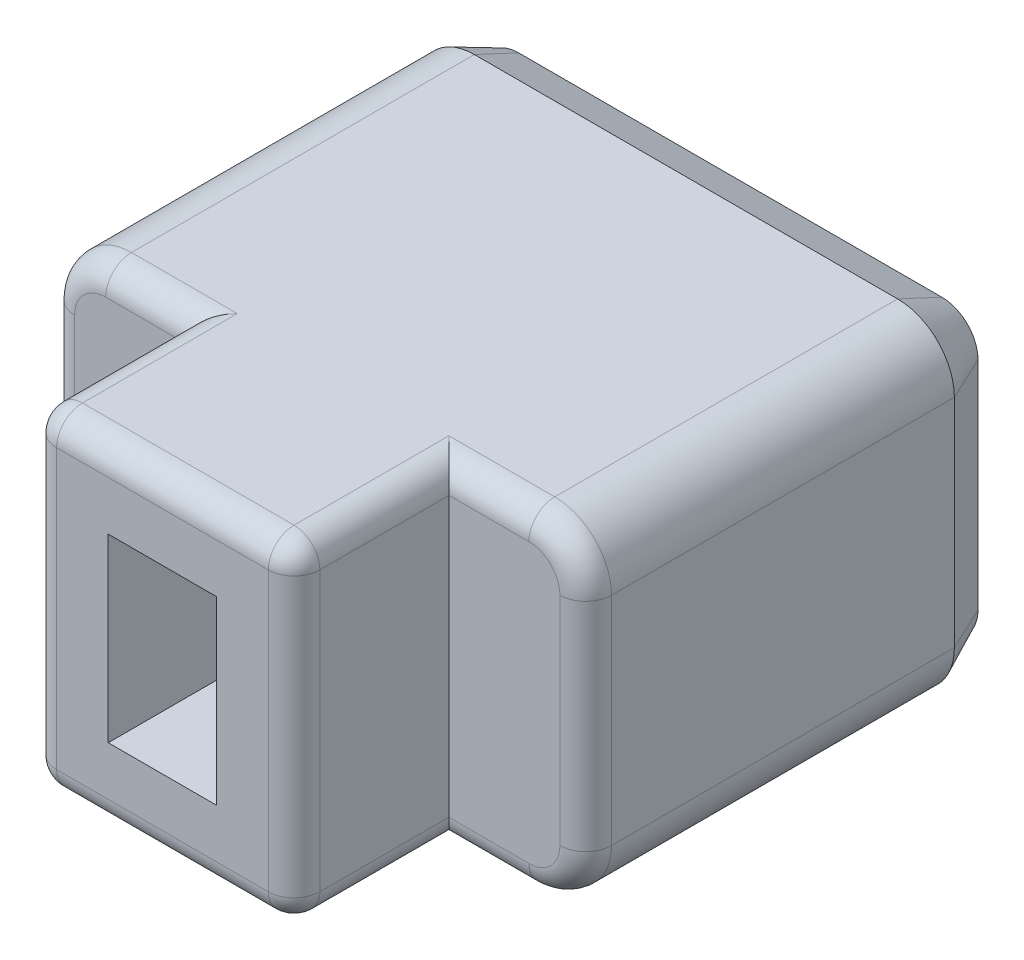
from build123d import *

# Parameters (mm, degrees)
BOSS_EXTRU_1_DEPTH      = 11
ESQUISSE3_W             = 2.1
ESQUISSE3_H             = 3.5
ENL_V_MAT_EXTRU_1_DEPTH = 3
ESQUISSE4_OUTSIDE_W     = 15.688
ESQUISSE4_OUTSIDE_H     = 11.688
ESQUISSE4_OUTSIDE_W_2   = 5.1
ESQUISSE4_OUTSIDE_H_2   = 6.4
ENL_V_MAT_EXTRU_2_DEPTH = 3
CONG_1_R                = 0.5
CHANFREIN1_SIZE         = 0.4
CHANFREIN1_SIZE2        = 0.857802768
ENL_V_MAT_EXTRU_3_DEPTH = 0.3
BOSS_EXTRU_2_DEPTH      = 0.3


with BuildPart() as part:
    # Esquisse2 → Boss.-Extru.1 (new body)
    with BuildSketch(Plane.XY):
        with BuildLine():
            Line((1.1, 0), (9.3, 0))
            ThreePointArc((9.3, 0), (10.077817459, 0.322182541), (10.4, 1.1))
            Line((10.4, 1.1), (10.4, 5.3))
            ThreePointArc((10.4, 5.3), (10.077817459, 6.077817459), (9.3, 6.4))
            Line((9.3, 6.4), (1.1, 6.4))
            ThreePointArc((1.1, 6.4), (0.322182541, 6.077817459), (0, 5.3))
            Line((0, 5.3), (0, 1.1))
            ThreePointArc((0, 1.1), (0.322182541, 0.322182541), (1.1, 0))
        make_face()
    extrude(amount=BOSS_EXTRU_1_DEPTH)

    # Esquisse3 → Enlèv. mat.-Extru.1 (cut)
    with BuildSketch(Plane.XY.offset(11)):
        with Locations((5.2, 3.2)):
            Rectangle(ESQUISSE3_W, ESQUISSE3_H)
    extrude(amount=-ENL_V_MAT_EXTRU_1_DEPTH, mode=Mode.SUBTRACT)

    # Esquisse4 outside → Enlèv. mat.-Extru.2 (cut)
    with BuildSketch(Plane.XY.offset(11)):
        with Locations((5.2, 3.2)):
            Rectangle(ESQUISSE4_OUTSIDE_W, ESQUISSE4_OUTSIDE_H)
        with Locations((5.2, 3.2)):
            Rectangle(ESQUISSE4_OUTSIDE_W_2, ESQUISSE4_OUTSIDE_H_2, mode=Mode.SUBTRACT)
    extrude(amount=-ENL_V_MAT_EXTRU_2_DEPTH, mode=Mode.SUBTRACT)

    # Congé1
    cong_1_edges = [part.edges().sort_by_distance(p)[0] for p in [
        (8.525, 0, 8),
        (10.077817459, 0.322182541, 8),
        (10.4, 3.2, 8),
        (10.077817459, 6.077817459, 8),
        (1.875, 6.4, 8),
        (0.322182541, 6.077817459, 8),
        (1.875, 0, 8),
        (0.322182541, 0.322182541, 8),
        (7.75, 6.4, 9.5),
        (2.65, 6.4, 9.5),
        (7.75, 0, 9.5),
        (2.65, 0, 9.5),
        (2.65, 3.2, 11),
        (5.2, 6.4, 11),
        (7.75, 3.2, 11),
        (5.2, 0, 11),
        (8.525, 6.4, 8),
        (0, 3.2, 8),
    ]]
    fillet(cong_1_edges, radius=CONG_1_R)

    # Chanfrein1
    chanfrein1_edges = [part.edges().sort_by_distance(p)[0] for p in [
        (5.2, 0, 0),
        (10.077817459, 0.322182541, 0),
        (0.322182541, 0.322182541, 0),
        (10.4, 3.2, 0),
        (0, 3.2, 0),
        (10.077817459, 6.077817459, 0),
        (0.322182541, 6.077817459, 0),
        (5.2, 6.4, 0),
    ]]
    chanfrein1_side = [part.faces().sort_by_distance(p)[0] for p in [
        (5.2, 3.2, 0),
    ]]
    chamfer(chanfrein1_edges, length=CHANFREIN1_SIZE, length2=CHANFREIN1_SIZE2, reference=chanfrein1_side[0])

    # Esquisse5 → Enlèv. mat.-Extru.3 (cut)
    with BuildSketch(Plane(origin=(0, 0, 0), x_dir=(-1, 0, 0), z_dir=(0, 0, -1))):
        with BuildLine():
            add(Edge.make_bspline(
                [(-4.020512821, 3.301602564), (-4.020911895, 3.237490288), (-4.021687033, 3.112962487), (-4.029453623, 2.931576965), (-4.039657895, 2.761233687), (-4.057122867, 2.602328729), (-4.077002379, 2.454537409), (-4.103898836, 2.318336336), (-4.133686676, 2.192920764), (-4.169367746, 2.078306948), (-4.208966747, 1.972487166), (-4.251922765, 1.873844337), (-4.299609469, 1.781939083), (-4.350581864, 1.696493671), (-4.40515217, 1.617040024), (-4.464689277, 1.545195476), (-4.527264604, 1.478966922), (-4.593628357, 1.419548449), (-4.663626219, 1.367872957), (-4.73456264, 1.321609448), (-4.808375288, 1.283870803), (-4.883914016, 1.252464116), (-4.961582673, 1.227486437), (-5.041500205, 1.209823218), (-5.123314642, 1.199090447), (-5.178600222, 1.197989634), (-5.206410256, 1.197435897)],
                knots=[0, 0, 0, 0, 1.712877019, 3.326988582, 4.850328076, 6.271266393, 7.597414044, 8.833253358, 9.979089379, 11.039995979, 12.038127203, 12.996775837, 13.912827748, 14.802594919, 15.653836721, 16.485345673, 17.29299284, 18.086549745, 18.861567364, 19.615803961, 20.346722131, 21.07299196, 21.799717448, 22.523458425, 23.25726252, 24, 24, 24, 24], degree=3))
            add(Edge.make_bspline(
                [(-5.206410256, 1.197435897), (-5.234773835, 1.197856676), (-5.290931895, 1.19868979), (-5.373768848, 1.211289031), (-5.455148845, 1.226953307), (-5.533810837, 1.252867378), (-5.61135316, 1.283376293), (-5.685468102, 1.32376974), (-5.75931599, 1.368008245), (-5.829261029, 1.421642984), (-5.898136448, 1.480451636), (-5.961439201, 1.54819639), (-6.022536833, 1.621629), (-6.078767075, 1.702788043), (-6.133147302, 1.790327967), (-6.182067331, 1.885541033), (-6.228148466, 1.987395506), (-6.270739365, 2.096320958), (-6.308639603, 2.214278611), (-6.34094501, 2.341477387), (-6.369350367, 2.478020647), (-6.390869392, 2.624206004), (-6.410234178, 2.779852196), (-6.420894706, 2.945461394), (-6.429824742, 3.120416408), (-6.430448929, 3.240157327), (-6.430769231, 3.301602564)],
                knots=[0, 0, 0, 0, 0.75220614, 1.489319695, 2.220852219, 2.949733443, 3.684523869, 4.429947492, 5.187648757, 5.967684849, 6.766858157, 7.589441672, 8.425666629, 9.301140101, 10.208430577, 11.15995201, 12.140621658, 13.175675118, 14.263319269, 15.427708189, 16.65850267, 17.964291952, 19.349626439, 20.821361425, 22.36887671, 24, 24, 24, 24], degree=3))
            add(Edge.make_bspline(
                [(-6.430769231, 3.301602564), (-6.430305798, 3.362772851), (-6.429400854, 3.482219717), (-6.422438193, 3.656491702), (-6.409516659, 3.821099271), (-6.392113842, 3.975880645), (-6.369738278, 4.121323191), (-6.342767352, 4.257209095), (-6.311127821, 4.383693823), (-6.272926435, 4.500301893), (-6.231316538, 4.608939827), (-6.185570494, 4.710359268), (-6.135679901, 4.804839083), (-6.083447544, 4.893272292), (-6.025939867, 4.9738605), (-5.965001727, 5.047871088), (-5.900246961, 5.11521968), (-5.831706612, 5.175510083), (-5.760942229, 5.229184526), (-5.687219152, 5.275093881), (-5.612067139, 5.314500495), (-5.534640973, 5.346843735), (-5.455223062, 5.371759948), (-5.373900341, 5.389028282), (-5.290912286, 5.401226646), (-5.234767255, 5.402115282), (-5.206410256, 5.402564103)],
                knots=[0, 0, 0, 0, 1.625926502, 3.174937312, 4.634762286, 6.013840289, 7.314135796, 8.544953558, 9.695183173, 10.777339882, 11.80441546, 12.786228703, 13.732569224, 14.643300609, 15.513996549, 16.361191109, 17.189646031, 17.994430762, 18.785317065, 19.547646725, 20.300227906, 21.038576587, 21.77507982, 22.508943555, 23.246916685, 24, 24, 24, 24], degree=3))
            add(Edge.make_bspline(
                [(-5.206410256, 5.402564103), (-5.178600626, 5.402008333), (-5.12331585, 5.400903477), (-5.041495467, 5.390200606), (-4.961927768, 5.372498277), (-4.884580833, 5.348113076), (-4.808735986, 5.318115591), (-4.735861577, 5.278841166), (-4.664487612, 5.234097305), (-4.595222355, 5.182839794), (-4.529714735, 5.123954272), (-4.466751428, 5.05907494), (-4.408306603, 4.986310676), (-4.353077748, 4.907111679), (-4.301846212, 4.82107942), (-4.254304118, 4.728554016), (-4.211513446, 4.62894977), (-4.170950898, 4.522524223), (-4.134313743, 4.407207152), (-4.104784709, 4.281097892), (-4.078108159, 4.144586926), (-4.056489297, 3.997009974), (-4.04121196, 3.838384286), (-4.028981243, 3.669013656), (-4.021823954, 3.488897211), (-4.020957867, 3.365177206), (-4.020512821, 3.301602564)],
                knots=[0, 0, 0, 0, 0.743633083, 1.478322008, 2.202935681, 2.92157138, 3.646008898, 4.381114629, 5.13243131, 5.898384423, 6.682810379, 7.486269515, 8.314261655, 9.176475297, 10.067315361, 10.990823262, 11.957174424, 12.9657133, 14.036849175, 15.191010145, 16.42833965, 17.757104916, 19.17902079, 20.690427988, 22.299346516, 24, 24, 24, 24], degree=3))
        make_face()
        with BuildLine():
            add(Edge.make_bspline(
                [(-4.379487179, 3.3), (-4.379779587, 3.35342219), (-4.380346983, 3.457084295), (-4.385135243, 3.607509198), (-4.393150158, 3.748039045), (-4.403751897, 3.87854911), (-4.419474197, 3.998686179), (-4.436327385, 4.109049288), (-4.458195662, 4.208923878), (-4.48220677, 4.299943929), (-4.509664627, 4.383098612), (-4.540180964, 4.460417645), (-4.573871506, 4.532671188), (-4.610400803, 4.600127923), (-4.650953047, 4.661797332), (-4.692973295, 4.719458073), (-4.739951793, 4.770446886), (-4.803765354, 4.831502164), (-4.8877326, 4.89483389), (-4.994460009, 4.950833116), (-5.104920314, 4.985539091), (-5.180267725, 4.990064032), (-5.217628205, 4.992307692)],
                knots=[0, 0, 0, 0, 1.533890677, 2.976409912, 4.32068653, 5.57534731, 6.734899526, 7.799022707, 8.779764529, 9.668979878, 10.500817703, 11.292628284, 12.054302458, 12.788773575, 13.492867708, 14.172349036, 14.834736512, 15.480260857, 16.707312048, 17.839247027, 18.928605951, 20, 20, 20, 20], degree=3))
            add(Edge.make_bspline(
                [(-5.217628205, 4.992307692), (-5.255258229, 4.990389299), (-5.330571538, 4.986549798), (-5.440929763, 4.952267022), (-5.547048839, 4.897685219), (-5.630071512, 4.835174339), (-5.692917561, 4.775508814), (-5.738412243, 4.724653285), (-5.77964842, 4.667650104), (-5.818091825, 4.60559545), (-5.854487742, 4.538574624), (-5.887978618, 4.466161896), (-5.917570334, 4.387773449), (-5.934766088, 4.333472445), (-5.943589744, 4.305608974)],
                knots=[0, 0, 0, 0, 1.259681964, 2.521146828, 3.839396011, 5.247784635, 5.989235103, 6.744415315, 7.532874599, 8.345794243, 9.191666684, 10.089598853, 11.019715999, 12, 12, 12, 12], degree=3))
            add(Edge.make_bspline(
                [(-5.943589744, 4.305608974), (-5.953720959, 4.269886717), (-5.974334837, 4.19720302), (-6.001119453, 4.084815833), (-6.021943913, 3.966950118), (-6.041121335, 3.844185221), (-6.053890378, 3.715740449), (-6.064938775, 3.581950987), (-6.069986658, 3.442665729), (-6.071185495, 3.348079077), (-6.071794872, 3.3)],
                knots=[0, 0, 0, 0, 0.875956533, 1.782299469, 2.724069677, 3.698984639, 4.712850366, 5.768333165, 6.865627682, 8, 8, 8, 8], degree=3))
            add(Edge.make_bspline(
                [(-6.071794872, 3.3), (-6.071584733, 3.251915565), (-6.07117364, 3.157848583), (-6.065125373, 3.020268389), (-6.056917984, 2.889261457), (-6.043393351, 2.765138771), (-6.029287693, 2.6472717), (-6.008647133, 2.536498336), (-5.985686678, 2.432182443), (-5.95923148, 2.334316961), (-5.929979671, 2.242949321), (-5.896586545, 2.158459438), (-5.861857442, 2.079681886), (-5.823226662, 2.007580001), (-5.782462568, 1.941593056), (-5.738905975, 1.881777873), (-5.692898579, 1.828043293), (-5.628385253, 1.767291709), (-5.544808554, 1.704214198), (-5.438953102, 1.64849731), (-5.329182829, 1.614567615), (-5.254711982, 1.609977846), (-5.217628205, 1.607692308)],
                knots=[0, 0, 0, 0, 1.380925582, 2.701487514, 3.954759264, 5.150134482, 6.287201315, 7.363077027, 8.384863176, 9.354399778, 10.273840592, 11.138560363, 11.96264889, 12.745125087, 13.485915552, 14.188670158, 14.868482057, 15.51419708, 16.73087182, 17.863141155, 18.935921919, 20, 20, 20, 20], degree=3))
            add(Edge.make_bspline(
                [(-5.217628205, 1.607692308), (-5.180016158, 1.609983366), (-5.104508137, 1.614582777), (-4.993344019, 1.648315702), (-4.886608666, 1.704014744), (-4.802784125, 1.767221715), (-4.739080074, 1.827657633), (-4.693352401, 1.879199527), (-4.650532879, 1.935582312), (-4.61137998, 1.997766084), (-4.574810877, 2.06470837), (-4.5408126, 2.136564551), (-4.510413915, 2.213687917), (-4.483306315, 2.296997893), (-4.457601906, 2.387603306), (-4.437762769, 2.488237199), (-4.41873708, 2.598723374), (-4.405310355, 2.719729036), (-4.392696573, 2.85028734), (-4.38524976, 2.991168731), (-4.380313644, 3.142110882), (-4.37976822, 3.24630947), (-4.379487179, 3.3)],
                knots=[0, 0, 0, 0, 1.078426572, 2.164993967, 3.303109781, 4.518750912, 5.163917377, 5.820815102, 6.493793122, 7.193352139, 7.927416062, 8.681729197, 9.473100796, 10.304477447, 11.195213749, 12.173822244, 13.246157428, 14.41173915, 15.666383497, 17.009914843, 18.459295279, 20, 20, 20, 20], degree=3))
        make_face(mode=Mode.SUBTRACT)
    extrude(amount=-ENL_V_MAT_EXTRU_3_DEPTH, mode=Mode.SUBTRACT)


with BuildPart() as body_2:
    # Esquisse5<2> → Boss.-Extru.2 (new body)
    with BuildSketch(Plane(origin=(0, 0, 0), x_dir=(-1, 0, 0), z_dir=(0, 0, -1))):
        with BuildLine():
            add(Edge.make_bspline(
                [(-4.020512821, 3.301602564), (-4.020911895, 3.237490288), (-4.021687033, 3.112962487), (-4.029453623, 2.931576965), (-4.039657895, 2.761233687), (-4.057122867, 2.602328729), (-4.077002379, 2.454537409), (-4.103898836, 2.318336336), (-4.133686676, 2.192920764), (-4.169367746, 2.078306948), (-4.208966747, 1.972487166), (-4.251922765, 1.873844337), (-4.299609469, 1.781939083), (-4.350581864, 1.696493671), (-4.40515217, 1.617040024), (-4.464689277, 1.545195476), (-4.527264604, 1.478966922), (-4.593628357, 1.419548449), (-4.663626219, 1.367872957), (-4.73456264, 1.321609448), (-4.808375288, 1.283870803), (-4.883914016, 1.252464116), (-4.961582673, 1.227486437), (-5.041500205, 1.209823218), (-5.123314642, 1.199090447), (-5.178600222, 1.197989634), (-5.206410256, 1.197435897)],
                knots=[0, 0, 0, 0, 1.712877019, 3.326988582, 4.850328076, 6.271266393, 7.597414044, 8.833253358, 9.979089379, 11.039995979, 12.038127203, 12.996775837, 13.912827748, 14.802594919, 15.653836721, 16.485345673, 17.29299284, 18.086549745, 18.861567364, 19.615803961, 20.346722131, 21.07299196, 21.799717448, 22.523458425, 23.25726252, 24, 24, 24, 24], degree=3))
            add(Edge.make_bspline(
                [(-5.206410256, 1.197435897), (-5.234773835, 1.197856676), (-5.290931895, 1.19868979), (-5.373768848, 1.211289031), (-5.455148845, 1.226953307), (-5.533810837, 1.252867378), (-5.61135316, 1.283376293), (-5.685468102, 1.32376974), (-5.75931599, 1.368008245), (-5.829261029, 1.421642984), (-5.898136448, 1.480451636), (-5.961439201, 1.54819639), (-6.022536833, 1.621629), (-6.078767075, 1.702788043), (-6.133147302, 1.790327967), (-6.182067331, 1.885541033), (-6.228148466, 1.987395506), (-6.270739365, 2.096320958), (-6.308639603, 2.214278611), (-6.34094501, 2.341477387), (-6.369350367, 2.478020647), (-6.390869392, 2.624206004), (-6.410234178, 2.779852196), (-6.420894706, 2.945461394), (-6.429824742, 3.120416408), (-6.430448929, 3.240157327), (-6.430769231, 3.301602564)],
                knots=[0, 0, 0, 0, 0.75220614, 1.489319695, 2.220852219, 2.949733443, 3.684523869, 4.429947492, 5.187648757, 5.967684849, 6.766858157, 7.589441672, 8.425666629, 9.301140101, 10.208430577, 11.15995201, 12.140621658, 13.175675118, 14.263319269, 15.427708189, 16.65850267, 17.964291952, 19.349626439, 20.821361425, 22.36887671, 24, 24, 24, 24], degree=3))
            add(Edge.make_bspline(
                [(-6.430769231, 3.301602564), (-6.430305798, 3.362772851), (-6.429400854, 3.482219717), (-6.422438193, 3.656491702), (-6.409516659, 3.821099271), (-6.392113842, 3.975880645), (-6.369738278, 4.121323191), (-6.342767352, 4.257209095), (-6.311127821, 4.383693823), (-6.272926435, 4.500301893), (-6.231316538, 4.608939827), (-6.185570494, 4.710359268), (-6.135679901, 4.804839083), (-6.083447544, 4.893272292), (-6.025939867, 4.9738605), (-5.965001727, 5.047871088), (-5.900246961, 5.11521968), (-5.831706612, 5.175510083), (-5.760942229, 5.229184526), (-5.687219152, 5.275093881), (-5.612067139, 5.314500495), (-5.534640973, 5.346843735), (-5.455223062, 5.371759948), (-5.373900341, 5.389028282), (-5.290912286, 5.401226646), (-5.234767255, 5.402115282), (-5.206410256, 5.402564103)],
                knots=[0, 0, 0, 0, 1.625926502, 3.174937312, 4.634762286, 6.013840289, 7.314135796, 8.544953558, 9.695183173, 10.777339882, 11.80441546, 12.786228703, 13.732569224, 14.643300609, 15.513996549, 16.361191109, 17.189646031, 17.994430762, 18.785317065, 19.547646725, 20.300227906, 21.038576587, 21.77507982, 22.508943555, 23.246916685, 24, 24, 24, 24], degree=3))
            add(Edge.make_bspline(
                [(-5.206410256, 5.402564103), (-5.178600626, 5.402008333), (-5.12331585, 5.400903477), (-5.041495467, 5.390200606), (-4.961927768, 5.372498277), (-4.884580833, 5.348113076), (-4.808735986, 5.318115591), (-4.735861577, 5.278841166), (-4.664487612, 5.234097305), (-4.595222355, 5.182839794), (-4.529714735, 5.123954272), (-4.466751428, 5.05907494), (-4.408306603, 4.986310676), (-4.353077748, 4.907111679), (-4.301846212, 4.82107942), (-4.254304118, 4.728554016), (-4.211513446, 4.62894977), (-4.170950898, 4.522524223), (-4.134313743, 4.407207152), (-4.104784709, 4.281097892), (-4.078108159, 4.144586926), (-4.056489297, 3.997009974), (-4.04121196, 3.838384286), (-4.028981243, 3.669013656), (-4.021823954, 3.488897211), (-4.020957867, 3.365177206), (-4.020512821, 3.301602564)],
                knots=[0, 0, 0, 0, 0.743633083, 1.478322008, 2.202935681, 2.92157138, 3.646008898, 4.381114629, 5.13243131, 5.898384423, 6.682810379, 7.486269515, 8.314261655, 9.176475297, 10.067315361, 10.990823262, 11.957174424, 12.9657133, 14.036849175, 15.191010145, 16.42833965, 17.757104916, 19.17902079, 20.690427988, 22.299346516, 24, 24, 24, 24], degree=3))
        make_face()
        with BuildLine():
            add(Edge.make_bspline(
                [(-4.379487179, 3.3), (-4.379779587, 3.35342219), (-4.380346983, 3.457084295), (-4.385135243, 3.607509198), (-4.393150158, 3.748039045), (-4.403751897, 3.87854911), (-4.419474197, 3.998686179), (-4.436327385, 4.109049288), (-4.458195662, 4.208923878), (-4.48220677, 4.299943929), (-4.509664627, 4.383098612), (-4.540180964, 4.460417645), (-4.573871506, 4.532671188), (-4.610400803, 4.600127923), (-4.650953047, 4.661797332), (-4.692973295, 4.719458073), (-4.739951793, 4.770446886), (-4.803765354, 4.831502164), (-4.8877326, 4.89483389), (-4.994460009, 4.950833116), (-5.104920314, 4.985539091), (-5.180267725, 4.990064032), (-5.217628205, 4.992307692)],
                knots=[0, 0, 0, 0, 1.533890677, 2.976409912, 4.32068653, 5.57534731, 6.734899526, 7.799022707, 8.779764529, 9.668979878, 10.500817703, 11.292628284, 12.054302458, 12.788773575, 13.492867708, 14.172349036, 14.834736512, 15.480260857, 16.707312048, 17.839247027, 18.928605951, 20, 20, 20, 20], degree=3))
            add(Edge.make_bspline(
                [(-5.217628205, 4.992307692), (-5.255258229, 4.990389299), (-5.330571538, 4.986549798), (-5.440929763, 4.952267022), (-5.547048839, 4.897685219), (-5.630071512, 4.835174339), (-5.692917561, 4.775508814), (-5.738412243, 4.724653285), (-5.77964842, 4.667650104), (-5.818091825, 4.60559545), (-5.854487742, 4.538574624), (-5.887978618, 4.466161896), (-5.917570334, 4.387773449), (-5.934766088, 4.333472445), (-5.943589744, 4.305608974)],
                knots=[0, 0, 0, 0, 1.259681964, 2.521146828, 3.839396011, 5.247784635, 5.989235103, 6.744415315, 7.532874599, 8.345794243, 9.191666684, 10.089598853, 11.019715999, 12, 12, 12, 12], degree=3))
            add(Edge.make_bspline(
                [(-5.943589744, 4.305608974), (-5.953720959, 4.269886717), (-5.974334837, 4.19720302), (-6.001119453, 4.084815833), (-6.021943913, 3.966950118), (-6.041121335, 3.844185221), (-6.053890378, 3.715740449), (-6.064938775, 3.581950987), (-6.069986658, 3.442665729), (-6.071185495, 3.348079077), (-6.071794872, 3.3)],
                knots=[0, 0, 0, 0, 0.875956533, 1.782299469, 2.724069677, 3.698984639, 4.712850366, 5.768333165, 6.865627682, 8, 8, 8, 8], degree=3))
            add(Edge.make_bspline(
                [(-6.071794872, 3.3), (-6.071584733, 3.251915565), (-6.07117364, 3.157848583), (-6.065125373, 3.020268389), (-6.056917984, 2.889261457), (-6.043393351, 2.765138771), (-6.029287693, 2.6472717), (-6.008647133, 2.536498336), (-5.985686678, 2.432182443), (-5.95923148, 2.334316961), (-5.929979671, 2.242949321), (-5.896586545, 2.158459438), (-5.861857442, 2.079681886), (-5.823226662, 2.007580001), (-5.782462568, 1.941593056), (-5.738905975, 1.881777873), (-5.692898579, 1.828043293), (-5.628385253, 1.767291709), (-5.544808554, 1.704214198), (-5.438953102, 1.64849731), (-5.329182829, 1.614567615), (-5.254711982, 1.609977846), (-5.217628205, 1.607692308)],
                knots=[0, 0, 0, 0, 1.380925582, 2.701487514, 3.954759264, 5.150134482, 6.287201315, 7.363077027, 8.384863176, 9.354399778, 10.273840592, 11.138560363, 11.96264889, 12.745125087, 13.485915552, 14.188670158, 14.868482057, 15.51419708, 16.73087182, 17.863141155, 18.935921919, 20, 20, 20, 20], degree=3))
            add(Edge.make_bspline(
                [(-5.217628205, 1.607692308), (-5.180016158, 1.609983366), (-5.104508137, 1.614582777), (-4.993344019, 1.648315702), (-4.886608666, 1.704014744), (-4.802784125, 1.767221715), (-4.739080074, 1.827657633), (-4.693352401, 1.879199527), (-4.650532879, 1.935582312), (-4.61137998, 1.997766084), (-4.574810877, 2.06470837), (-4.5408126, 2.136564551), (-4.510413915, 2.213687917), (-4.483306315, 2.296997893), (-4.457601906, 2.387603306), (-4.437762769, 2.488237199), (-4.41873708, 2.598723374), (-4.405310355, 2.719729036), (-4.392696573, 2.85028734), (-4.38524976, 2.991168731), (-4.380313644, 3.142110882), (-4.37976822, 3.24630947), (-4.379487179, 3.3)],
                knots=[0, 0, 0, 0, 1.078426572, 2.164993967, 3.303109781, 4.518750912, 5.163917377, 5.820815102, 6.493793122, 7.193352139, 7.927416062, 8.681729197, 9.473100796, 10.304477447, 11.195213749, 12.173822244, 13.246157428, 14.41173915, 15.666383497, 17.009914843, 18.459295279, 20, 20, 20, 20], degree=3))
        make_face(mode=Mode.SUBTRACT)
    extrude(amount=BOSS_EXTRU_2_DEPTH)


solid = Compound([part.part, body_2.part])
